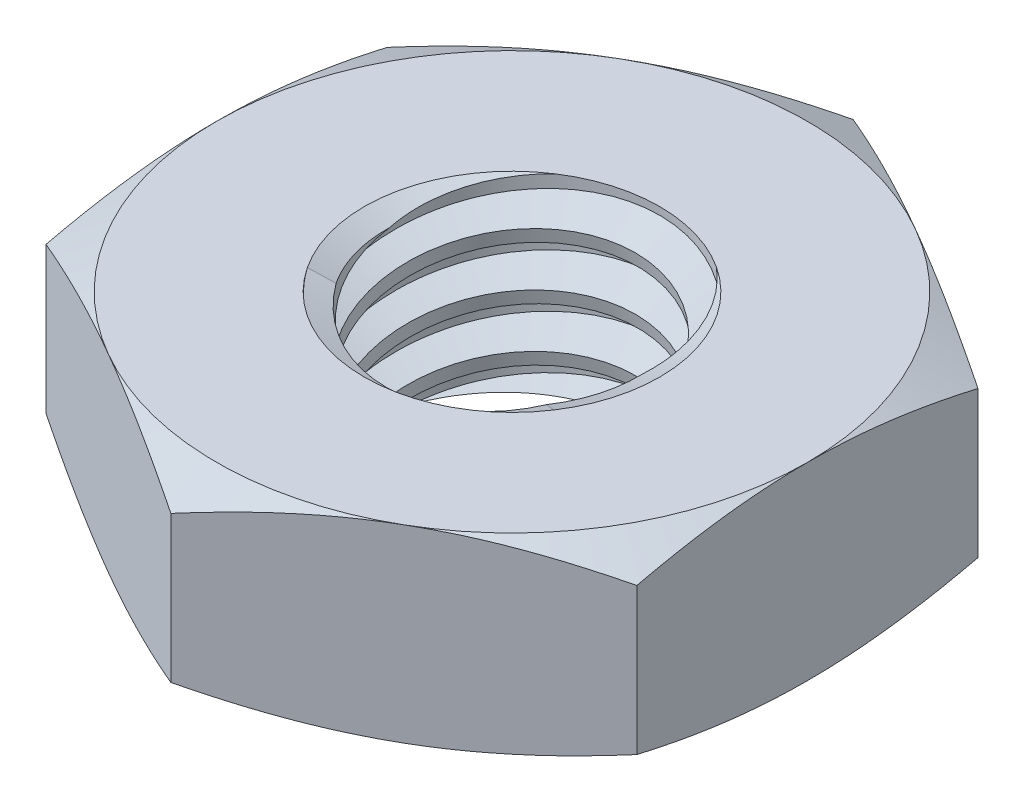
from build123d import *

# Parameters (mm, degrees)
EXTRUDE1_DEPTH       = 0.8
SKETCH2_W            = 1.25
SKETCH2_H            = 1.6
LPATTERN1_COUNT      = 4
LPATTERN1_PITCH      = 0.45
LPATTERN1_COUNT_DIR2 = 2
LPATTERN1_PITCH_DIR2 = 0.45


with BuildPart() as part:
    # Sketch1 → Extrude1 (new, symmetric)
    with BuildSketch(Plane(origin=(0, 0, 0), x_dir=(1, 0, 0), z_dir=(0, 1, 0))):
        Polygon((0, 2.886751346), (-2.5, 1.443375673), (-2.5, -1.443375673), (0, -2.886751346), (2.5, -1.443375673), (2.5, 1.443375673), align=None)
    extrude(amount=EXTRUDE1_DEPTH, both=True)

    # Sketch4 → Cut-Revolve2 (revolve, cut)
    with BuildSketch(Plane(origin=(0, 0, 0), x_dir=(0, 0, -1), z_dir=(1, 0, 0))):
        Polygon((0, 0.8), (1.25, 0.8), (1.045159814, 0.704481453), (1.045159814, -0.704481453), (1.25, -0.8), (0, -0.8), align=None)
    revolve(axis=Axis((0, 0.8, 0), (0, 1, 0)), mode=Mode.SUBTRACT)


with BuildPart() as body_2:
    # Sketch2 → Revolve1 (revolve)
    with BuildSketch(Plane(origin=(0, 0, 0), x_dir=(0, 0, -1), z_dir=(1, 0, 0))):
        with Locations((0.625, 0)):
            Rectangle(SKETCH2_W, SKETCH2_H)
    revolve(axis=Axis((0, -2.05, 0), (0, 1, 0)))

    # Sketch3 → Cut-Revolve1 (revolve, cut)
    with BuildSketch(Plane(origin=(0, 0, 0), x_dir=(0, 0, -1), z_dir=(1, 0, 0))):
        Polygon((1.259964856, 0.744639688), (1.329718849, 0.357117504), (1.065089526, 0.452369191), (1.045159814, 0.563089815), align=None)
    cut_revolve1 = revolve(axis=Axis((0, 0.8, 0.086794729), (0, -0.9841833239736953, -0.17715299831526507)), mode=Mode.SUBTRACT)

    # LPattern1: Cut-Revolve1 4 × 2
    with Locations(*[Vector(0, -1, 0) * (i * LPATTERN1_PITCH) + Vector(0, 1, 0) * (j * LPATTERN1_PITCH_DIR2) for i in range(LPATTERN1_COUNT) for j in range(LPATTERN1_COUNT_DIR2) if (i, j) != (0, 0)]):
        add(cut_revolve1, mode=Mode.SUBTRACT)


with BuildPart() as part_1:
    add(part.part)

    # Combine1: cut body 2
    add(body_2.part, mode=Mode.SUBTRACT)

    # Sketch5 → Cut-Revolve3 (revolve, cut)
    with BuildSketch(Plane(origin=(0, 0, 0), x_dir=(0, 0, -1), z_dir=(1, 0, 0))):
        Polygon((0, -0.8), (2.5, -0.8), (2.886751346, -0.619654886), (2.886751346, 0.619654886), (2.5, 0.8), (0, 0.8), (0, 2.07), (4.156751346, 2.07), (4.156751346, -2.07), (0, -2.07), align=None)
    revolve(axis=Axis((0, -0.8, 0), (0, 1, 0)), mode=Mode.SUBTRACT)


solid = part_1.part
